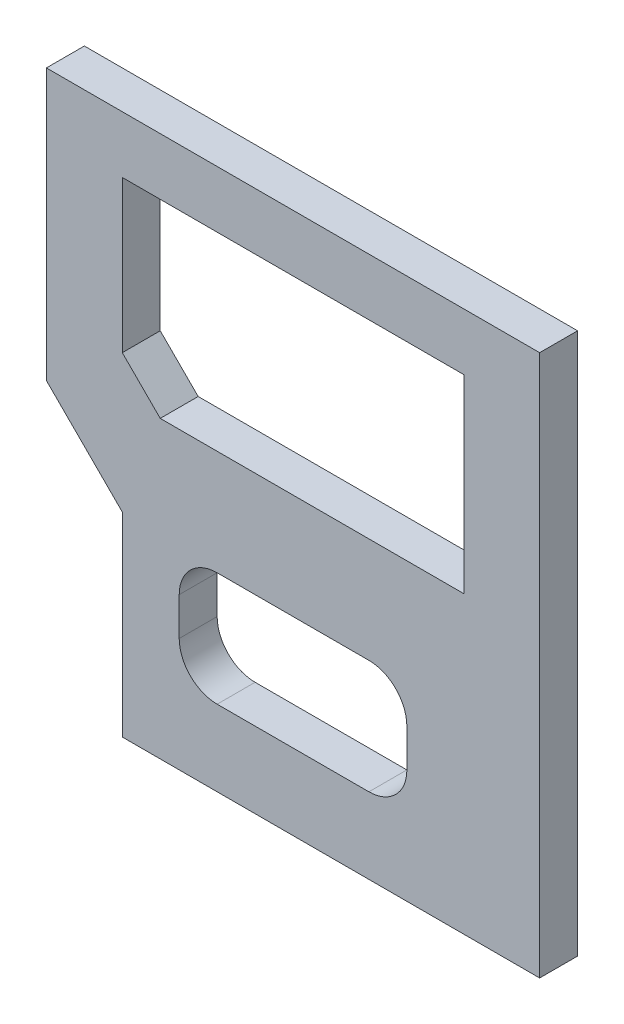
from build123d import *

# Parameters (mm, degrees)
EXTRUDE_1_DEPTH = 10


with BuildPart() as part:
    # 草图1 → 凸台-拉伸1 (new body)
    with BuildSketch(Plane.XY):
        Polygon((-65, 0), (-45, -20), (-45, -71.366959064), (65, -71.366959064), (65, 71.366959064), (-65, 71.366959064), align=None)
        Polygon((45, 56.366959064), (-45, 56.366959064), (-45, 16.366959064), (-35, 6.366959064), (45, 6.366959064), align=None, mode=Mode.SUBTRACT)
        with BuildLine():
            Line((20, -21.366959064), (-20, -21.366959064))
            ThreePointArc((-20, -21.366959064), (-27.071067812, -24.295891252), (-30, -31.366959064))
            Line((-30, -31.366959064), (-30, -41.366959064))
            ThreePointArc((-30, -41.366959064), (-27.071067812, -48.438026876), (-20, -51.366959064))
            Line((-20, -51.366959064), (20, -51.366959064))
            ThreePointArc((20, -51.366959064), (27.071067812, -48.438026876), (30, -41.366959064))
            Line((30, -41.366959064), (30, -31.366959064))
            ThreePointArc((30, -31.366959064), (27.071067812, -24.295891252), (20, -21.366959064))
        make_face(mode=Mode.SUBTRACT)
    extrude(amount=EXTRUDE_1_DEPTH)


solid = part.part
